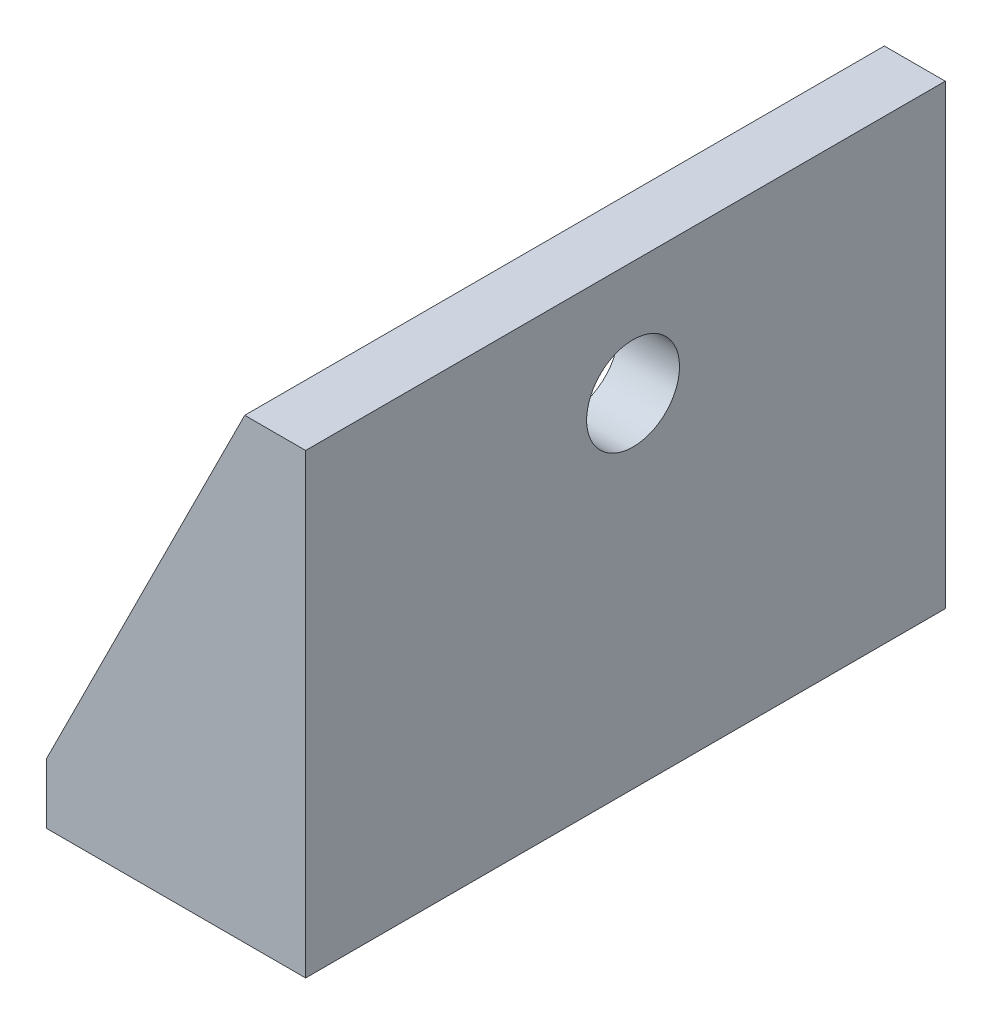
from build123d import *

# Parameters (mm, degrees)
SKETCH1_W                = 13
SKETCH1_H                = 42
SKETCH1_R                = 1.75
BOSS_EXTRUDE1_DEPTH      = 4
SKETCH1_3_W              = 2
SKETCH1_3_H              = 42
BOSS_EXTRUDE2_DEPTH      = 30
SKETCH3_R                = 3.1
CUT_EXTRUDE1_DEPTH       = 50
RIB1_REACH               = 54.156
SKETCH4_WALL_W           = 135.380915612
SKETCH4_WALL_H           = 2
CUT_EXTRUDE2_DEPTH       = 2.5
BOSS_EXTRUDE3_DEPTH      = 2
BOSS_EXTRUDE3_DEPTH_BACK = 2
SKETCH7_W                = 42
SKETCH7_H                = 30
SKETCH8_R                = 3.05
CUT_EXTRUDE3_DEPTH       = 12


with BuildPart() as part:
    # Sketch1 → Boss-Extrude1 (new body)
    with BuildSketch(Plane(origin=(0, 0, 0), x_dir=(1, 0, 0), z_dir=(0, 1, 0))):
        with Locations((-1, 0)):
            Rectangle(SKETCH1_W, SKETCH1_H)
        with Locations((0.72, -14)):
            Circle(SKETCH1_R, mode=Mode.SUBTRACT)
        with Locations((0.72, 14)):
            Circle(SKETCH1_R, mode=Mode.SUBTRACT)
    extrude(amount=BOSS_EXTRUDE1_DEPTH)

    # Sketch1<3> → Boss-Extrude2 (add)
    with BuildSketch(Plane(origin=(0, 0, 0), x_dir=(1, 0, 0), z_dir=(0, 1, 0))):
        with Locations((6.5, 0)):
            Rectangle(SKETCH1_3_W, SKETCH1_3_H)
    extrude(amount=BOSS_EXTRUDE2_DEPTH)

    # Sketch3 → Cut-Extrude1 (cut)
    with BuildSketch(Plane(origin=(7.5, 0, 0), x_dir=(0, 0, -1), z_dir=(1, 0, 0))):
        with Locations((0, 22.5)):
            Circle(SKETCH3_R)
    extrude(amount=-CUT_EXTRUDE1_DEPTH, mode=Mode.SUBTRACT)

    # Sketch4 wall → Rib1 (add, up to next)
    with BuildSketch(Plane(origin=(-1, 17, 21), x_dir=(0.4472135955, 0.894427191, 0), z_dir=(-0.894427191, 0.4472135955, 0)), mode=Mode.PRIVATE) as rib1_sk1:
        with Locations((0, 1)):
            Rectangle(SKETCH4_WALL_W, SKETCH4_WALL_H)
    rib1_tool1 = extrude(rib1_sk1.sketch, amount=-RIB1_REACH, mode=Mode.PRIVATE) - part.part
    rib1 = rib1_tool1.solids().sort_by_distance((-1, 17, 21))[0]
    add(rib1)

    # Mirror1: Rib1 across plane
    add(rib1.mirror(Plane.XY))

    # Sketch6 → Cut-Extrude2 (cut)
    with BuildSketch(Plane(origin=(0, 4, 0), x_dir=(1, 0, 0), z_dir=(0, 1, 0))):
        Polygon((-2.570896534, -14), (-0.925448267, -16.85), (2.365448267, -16.85), (4.010896534, -14), (2.365448267, -11.15), (-0.925448267, -11.15), align=None)
        Polygon((-2.570896534, 14), (-0.925448267, 11.15), (2.365448267, 11.15), (4.010896534, 14), (2.365448267, 16.85), (-0.925448267, 16.85), align=None)
    extrude(amount=-CUT_EXTRUDE2_DEPTH, mode=Mode.SUBTRACT)

    # Sketch7 → Boss-Extrude3 (add, two sides: drawn at the far end of the back side and taken through both)
    with BuildSketch(Plane(origin=(7.5, 0, 0), x_dir=(0, 0, -1), z_dir=(1, 0, 0)).offset(-BOSS_EXTRUDE3_DEPTH_BACK)):
        with Locations((0, 15)):
            Rectangle(SKETCH7_W, SKETCH7_H)
    extrude(amount=BOSS_EXTRUDE3_DEPTH + BOSS_EXTRUDE3_DEPTH_BACK)

    # Sketch8 → Cut-Extrude3 (cut)
    with BuildSketch(Plane(origin=(9.5, 0, 0), x_dir=(0, 0, -1), z_dir=(1, 0, 0))):
        with Locations((0.5, 22.5)):
            Circle(SKETCH8_R)
    extrude(amount=-CUT_EXTRUDE3_DEPTH, mode=Mode.SUBTRACT)


solid = part.part
